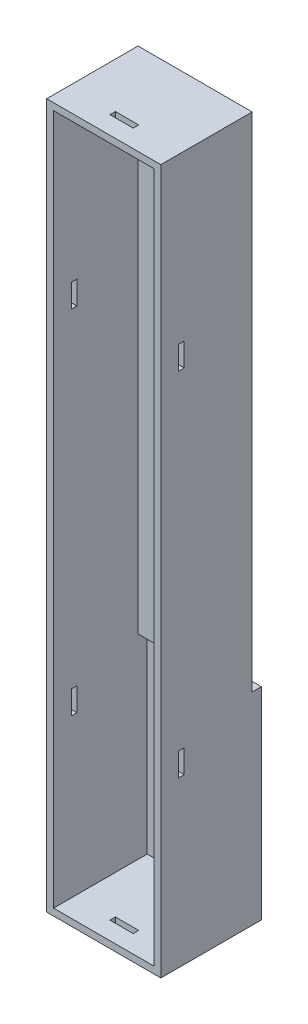
from build123d import *

# Parameters (mm, degrees)
SKETCH2_W           = 44.25
SKETCH2_H           = 25
SKETCH2_W_2         = 30.25
SKETCH2_H_2         = 11.75
BOSS_EXTRUDE1_DEPTH = 1.5
SKETCH3_W           = 25
SKETCH3_H           = 2
BOSS_EXTRUDE2_DEPTH = 110
BOSS_EXTRUDE3_DEPTH = 25
BOSS_EXTRUDE4_DEPTH = 7.3
SKETCH6_W           = 1.5
SKETCH6_H           = 7.3
BOSS_EXTRUDE5_DEPTH = 112
SKETCH8_W           = 1.5
SKETCH8_H           = 5.3
BOSS_EXTRUDE6_DEPTH = 22
SKETCH9_W           = 6.2
SKETCH9_H           = 6.2
CUT_EXTRUDE1_DEPTH  = 2
SKETCH10_W          = 25
SKETCH10_H          = 110
CUT_EXTRUDE2_DEPTH  = 0.5
SKETCH11_W          = 25
SKETCH11_H          = 154.25
SKETCH11_W_2        = 22
SKETCH11_H_2        = 151.25
BOSS_EXTRUDE7_DEPTH = 13.2
SKETCH12_W          = 5.1
SKETCH12_H          = 1.2
CUT_EXTRUDE3_DEPTH  = 158.803873527
SKETCH13_W          = 5.1
SKETCH13_H          = 1.2
CUT_EXTRUDE4_DEPTH  = 158.803873527


with BuildPart() as part:
    # Sketch2 → Boss-Extrude1 (new body)
    with BuildSketch(Plane(origin=(0, 0, 0), x_dir=(0, 1, 0), z_dir=(0, 0, 1))):
        with Locations((22.125, 12.5)):
            Rectangle(SKETCH2_W, SKETCH2_H)
        with Locations((20.625, 12.5)):
            Rectangle(SKETCH2_W_2, SKETCH2_H_2, mode=Mode.SUBTRACT)
    extrude(amount=BOSS_EXTRUDE1_DEPTH)



with BuildPart() as body_2:
    # Sketch3 → Boss-Extrude2 (new body)
    with BuildSketch(Plane(origin=(0, 44.25, 0), x_dir=(-1, 0, 0), z_dir=(0, 1, 0))):
        with Locations((12.5, 2.5)):
            Rectangle(SKETCH3_W, SKETCH3_H)
    extrude(amount=BOSS_EXTRUDE2_DEPTH)


with BuildPart() as part_1:
    add(part.part)

    add(body_2.part)  # Boss-Extrude3 merges body 2
    # Sketch4 → Boss-Extrude3 (add)
    with BuildSketch(Plane.YZ):
        Polygon((44.25, 3.5), (44.25, 1.5), (42.25, 1.5), align=None)
    extrude(amount=-BOSS_EXTRUDE3_DEPTH)

    # Sketch5 → Boss-Extrude4 (add)
    with BuildSketch(Plane.XY.offset(1.5)):
        Polygon((-1.5, 42.25), (-1.5, 1.5), (-23.5, 1.5), (-23.5, 42.25), (-25, 42.25), (-25, 0), (0, 0), (0, 42.25), align=None)
    extrude(amount=BOSS_EXTRUDE4_DEPTH)

    # Sketch6 → Boss-Extrude5 (add)
    with BuildSketch(Plane(origin=(0, 42.25, 0), x_dir=(-1, 0, 0), z_dir=(0, 1, 0))):
        with Locations((24.25, 5.15)):
            Rectangle(SKETCH6_W, SKETCH6_H)
        with Locations((0.75, 5.15)):
            Rectangle(SKETCH6_W, SKETCH6_H)
    extrude(amount=BOSS_EXTRUDE5_DEPTH)

    # Sketch8 → Boss-Extrude6 (add)
    with BuildSketch(Plane.YZ.offset(-23.5)):
        with Locations((153.5, 6.15)):
            Rectangle(SKETCH8_W, SKETCH8_H)
    extrude(amount=BOSS_EXTRUDE6_DEPTH)

    # Sketch9 → Cut-Extrude1 (cut)
    with BuildSketch(Plane(origin=(0, 0, 1.5), x_dir=(1, 0, 0), z_dir=(0, 0, -1))):
        with Locations((-12.5, -141.75)):
            Rectangle(SKETCH9_W, SKETCH9_H)
        with Locations((-12.5, -114.25)):
            Rectangle(SKETCH9_W, SKETCH9_H)
        with Locations((-12.5, -56.75)):
            Rectangle(SKETCH9_W, SKETCH9_H)
        with Locations((-12.5, -84.25)):
            Rectangle(SKETCH9_W, SKETCH9_H)
    extrude(amount=-CUT_EXTRUDE1_DEPTH, mode=Mode.SUBTRACT)

    # Sketch10 → Cut-Extrude2 (cut)
    with BuildSketch(Plane(origin=(0, 0, 1.5), x_dir=(1, 0, 0), z_dir=(0, 0, -1))):
        with Locations((-12.5, -99.25)):
            Rectangle(SKETCH10_W, SKETCH10_H)
    extrude(amount=-CUT_EXTRUDE2_DEPTH, mode=Mode.SUBTRACT)

    # Sketch11 → Boss-Extrude7 (add)
    with BuildSketch(Plane.XY.offset(8.8)):
        with Locations((-12.5, 77.125)):
            Rectangle(SKETCH11_W, SKETCH11_H)
        with Locations((-12.5, 77.125)):
            Rectangle(SKETCH11_W_2, SKETCH11_H_2, mode=Mode.SUBTRACT)
    extrude(amount=BOSS_EXTRUDE7_DEPTH)

    # Sketch12 → Cut-Extrude3 (cut, through all)
    with BuildSketch(Plane.XZ):
        with Locations((-12.5, 17.5)):
            Rectangle(SKETCH12_W, SKETCH12_H)
    extrude(amount=-CUT_EXTRUDE3_DEPTH, mode=Mode.SUBTRACT)

    # Sketch13 → Cut-Extrude4 (cut, through all)
    with BuildSketch(Plane.YZ):
        with Locations((38.5625, 17.5)):
            Rectangle(SKETCH13_W, SKETCH13_H)
    cut_extrude4 = extrude(amount=-CUT_EXTRUDE4_DEPTH, mode=Mode.SUBTRACT)

    # Mirror1: Cut-Extrude4 across plane
    add(cut_extrude4.mirror(Plane(origin=(0, 77.125, 0), x_dir=(0, 0, 1), z_dir=(0, -1, 0))), mode=Mode.SUBTRACT)


solid = part_1.part
